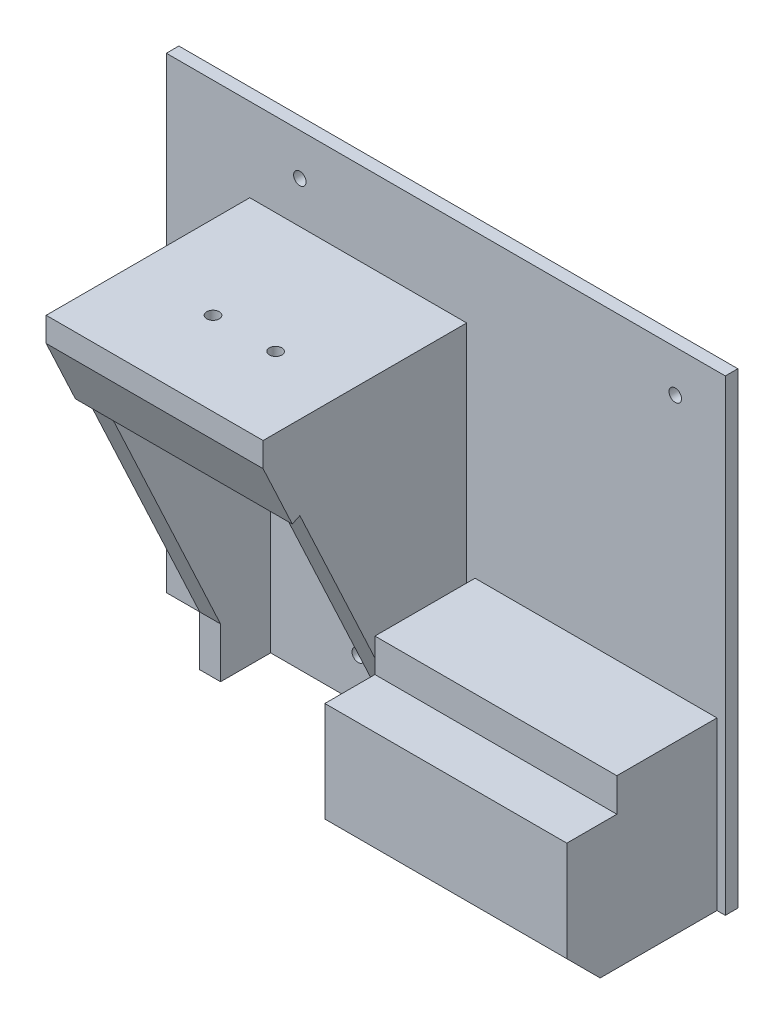
from build123d import *

# Parameters (mm, degrees)
SKETCH1_W           = 72
SKETCH1_H           = 92
BOSS_EXTRUDE1_DEPTH = 3
SKETCH2_W           = 5
SKETCH2_H           = 92
BOSS_EXTRUDE2_DEPTH = 47
BOSS_EXTRUDE3_REACH = 78.89
SKETCH3_W           = 52
SKETCH3_H           = 20
CUT_EXTRUDE3_REACH  = 87.557
SKETCH8_W           = 52
SKETCH8_H           = 16.552945357
BOSS_EXTRUDE5_DEPTH = 2
SKETCH9_W           = 52
SKETCH9_H           = 5
SKETCH9_H_2         = 0.845770931
BOSS_EXTRUDE6_DEPTH = 1.81237
SKETCH10_W          = 42
SKETCH10_H          = 40
CUT_EXTRUDE4_DEPTH  = 17
CUT_EXTRUDE5_REACH  = 113.555
SKETCH12_R          = 1.5
SKETCH13_W          = 72
SKETCH13_H          = 3
BOSS_EXTRUDE7_DEPTH = 20
SKETCH15_W          = 3
SKETCH15_H          = 112
BOSS_EXTRUDE8_DEPTH = 62
SKETCH17_W          = 58
SKETCH17_H          = 40
BOSS_EXTRUDE9_DEPTH = 36
CHAMFER1_SIZE       = 8
SKETCH18_W          = 58
SKETCH18_H          = 8
CUT_EXTRUDE8_DEPTH  = 12
CUT_EXTRUDE9_REACH  = 129.838
SKETCH14_R          = 1.5


with BuildPart() as part:
    # Sketch1 → Boss-Extrude1 (new body)
    with BuildSketch(Plane.XY):
        Rectangle(SKETCH1_W, SKETCH1_H)
    extrude(amount=BOSS_EXTRUDE1_DEPTH)

    # Sketch2 → Boss-Extrude2 (add)
    with BuildSketch(Plane.XY.offset(3)):
        with Locations((33.5, 0)):
            Rectangle(SKETCH2_W, SKETCH2_H)
        with Locations((-13.5, 0)):
            Rectangle(SKETCH2_W, SKETCH2_H)
    extrude(amount=BOSS_EXTRUDE2_DEPTH)

    # Sketch3 → Boss-Extrude3 (add, up to next)
    with BuildSketch(Plane.XY.offset(50), mode=Mode.PRIVATE) as boss_extrude3_sk1:
        with Locations((10, 36)):
            Rectangle(SKETCH3_W, SKETCH3_H)
    boss_extrude3_tool1 = extrude(boss_extrude3_sk1.sketch, amount=-BOSS_EXTRUDE3_REACH, mode=Mode.PRIVATE) - part.part
    add(boss_extrude3_tool1.solids().sort_by_distance((10, 36, 50))[0])

    # Sketch7 → Cut-Extrude3 (cut, up to next)
    with BuildSketch(Plane.ZY.offset(16), mode=Mode.PRIVATE) as cut_extrude3_sk1:
        Polygon((50, 41), (15, -34), (15, -46), (50, -46), align=None)
    cut_extrude3_tool1 = extrude(cut_extrude3_sk1.sketch, amount=-CUT_EXTRUDE3_REACH, mode=Mode.PRIVATE) & part.part
    add(cut_extrude3_tool1.solids().sort_by_distance((-16, -16.515152, 36.919192))[0], mode=Mode.SUBTRACT)

    # Sketch8 → Boss-Extrude5 (add)
    with BuildSketch(Plane(origin=(0, -11.828467153, 25.346715328), x_dir=(1, 0, 0), z_dir=(0, -0.42288546533112387, 0.9061831399952655))):
        with Locations((10, 50.021309328)):
            Rectangle(SKETCH8_W, SKETCH8_H)
    extrude(amount=BOSS_EXTRUDE5_DEPTH)

    # Sketch9 → Boss-Extrude6 (add)
    with BuildSketch(Plane.XY.offset(50)):
        with Locations((10, 43.5)):
            Rectangle(SKETCH9_W, SKETCH9_H)
        with Locations((10, 40.577114534)):
            Rectangle(SKETCH9_W, SKETCH9_H_2)
    extrude(amount=BOSS_EXTRUDE6_DEPTH)

    # Sketch10 → Cut-Extrude4 (cut)
    with BuildSketch(Plane.XZ.offset(-26)):
        with Locations((10, 23)):
            Rectangle(SKETCH10_W, SKETCH10_H)
    extrude(amount=-CUT_EXTRUDE4_DEPTH, mode=Mode.SUBTRACT)

    # Sketch12 → Cut-Extrude5 (cut, up to next)
    with BuildSketch(Plane(origin=(0, 46, 0), x_dir=(1, 0, 0), z_dir=(0, 1, 0)), mode=Mode.PRIVATE) as cut_extrude5_sk1:
        with Locations(Location((4, -31.81236628, 0), (0, 0, 270))):
            Circle(SKETCH12_R)
    cut_extrude5_tool1 = extrude(cut_extrude5_sk1.sketch, amount=-CUT_EXTRUDE5_REACH, mode=Mode.PRIVATE) & part.part
    # Sketch12 → Cut-Extrude5 (cut, up to next)
    with BuildSketch(Plane(origin=(0, 46, 0), x_dir=(1, 0, 0), z_dir=(0, 1, 0)), mode=Mode.PRIVATE) as cut_extrude5_sk2:
        with Locations(Location((19, -31.81236628, 0), (0, 0, 270))):
            Circle(SKETCH12_R)
    cut_extrude5_tool2 = extrude(cut_extrude5_sk2.sketch, amount=-CUT_EXTRUDE5_REACH, mode=Mode.PRIVATE) & part.part
    add(cut_extrude5_tool1.solids().sort_by_distance((4, 46, 31.812366))[0], mode=Mode.SUBTRACT)
    add(cut_extrude5_tool2.solids().sort_by_distance((19, 46, 31.812366))[0], mode=Mode.SUBTRACT)

    # Sketch13 → Boss-Extrude7 (add)
    with BuildSketch(Plane(origin=(0, 46, 0), x_dir=(1, 0, 0), z_dir=(0, 1, 0))):
        with Locations((0, -1.5)):
            Rectangle(SKETCH13_W, SKETCH13_H)
    extrude(amount=BOSS_EXTRUDE7_DEPTH)

    # Sketch15 → Boss-Extrude8 (add)
    with BuildSketch(Plane(origin=(36, 0, 0), x_dir=(0, 0, -1), z_dir=(1, 0, 0))):
        with Locations((-1.5, 10)):
            Rectangle(SKETCH15_W, SKETCH15_H)
    extrude(amount=BOSS_EXTRUDE8_DEPTH)

    # Sketch17 → Boss-Extrude9 (add)
    with BuildSketch(Plane.XY.offset(3)):
        with Locations((67, -26)):
            Rectangle(SKETCH17_W, SKETCH17_H)
    extrude(amount=BOSS_EXTRUDE9_DEPTH)

    # Chamfer1
    chamfer1_edges = [part.edges().sort_by_distance(p)[0] for p in [
        (67, -46, 39),
    ]]
    chamfer(chamfer1_edges, length=CHAMFER1_SIZE)

    # Sketch18 → Cut-Extrude8 (cut)
    with BuildSketch(Plane.XY.offset(39)):
        with Locations((67, -10)):
            Rectangle(SKETCH18_W, SKETCH18_H)
    extrude(amount=-CUT_EXTRUDE8_DEPTH, mode=Mode.SUBTRACT)

    # Sketch14 → Cut-Extrude9 (cut, up to next)
    with BuildSketch(Plane.XY.offset(3), mode=Mode.PRIVATE) as cut_extrude9_sk1:
        with Locations((86, 56)):
            Circle(SKETCH14_R)
    cut_extrude9_tool1 = extrude(cut_extrude9_sk1.sketch, amount=-CUT_EXTRUDE9_REACH, mode=Mode.PRIVATE) & part.part
    # Sketch14 → Cut-Extrude9 (cut, up to next)
    with BuildSketch(Plane.XY.offset(3), mode=Mode.PRIVATE) as cut_extrude9_sk2:
        with Locations((10, -36)):
            Circle(SKETCH14_R)
    cut_extrude9_tool2 = extrude(cut_extrude9_sk2.sketch, amount=-CUT_EXTRUDE9_REACH, mode=Mode.PRIVATE) & part.part
    # Sketch14 → Cut-Extrude9 (cut, up to next)
    with BuildSketch(Plane.XY.offset(3), mode=Mode.PRIVATE) as cut_extrude9_sk3:
        with Locations((-4, 56)):
            Circle(SKETCH14_R)
    cut_extrude9_tool3 = extrude(cut_extrude9_sk3.sketch, amount=-CUT_EXTRUDE9_REACH, mode=Mode.PRIVATE) & part.part
    add(cut_extrude9_tool1.solids().sort_by_distance((86, 56, 3))[0], mode=Mode.SUBTRACT)
    add(cut_extrude9_tool2.solids().sort_by_distance((10, -36, 3))[0], mode=Mode.SUBTRACT)
    add(cut_extrude9_tool3.solids().sort_by_distance((-4, 56, 3))[0], mode=Mode.SUBTRACT)


solid = part.part
